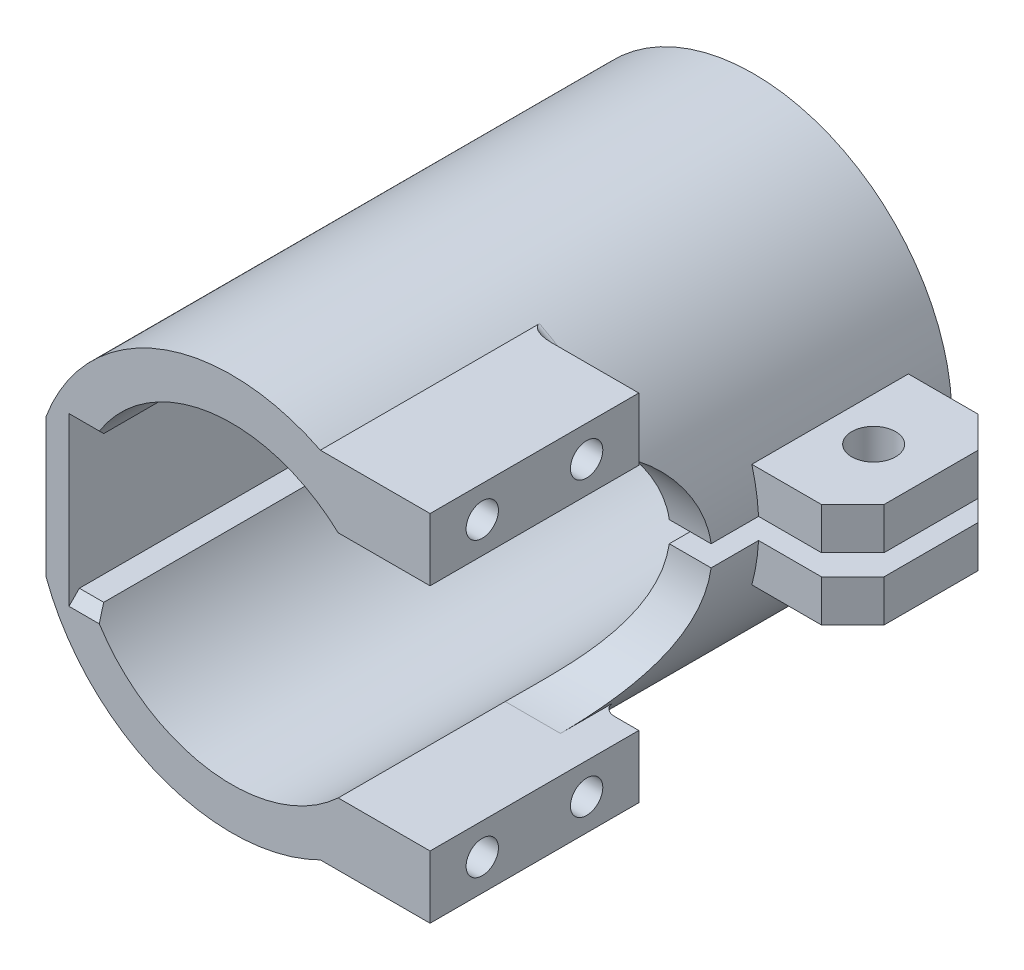
from build123d import *

# Parameters (mm, degrees)
SKETCH_1_R                = 19
EXTRUDE_2_DEPTH           = 55
SKETCH_11_W               = 5
SKETCH_11_H               = 14
CUT_EXTRUDE_10_DEPTH      = 40
EXTRUDE_4_DEPTH           = 9
EXTRUDE_4_DEPTH_BACK      = 2
SKETCH_12_W               = 15
SKETCH_12_H               = 10
SKETCH_13_R               = 2.1
CUT_EXTRUDE_11_DEPTH      = 67.219332525
SKETCH_19_R               = 19
CUT_EXTRUDE_17_DEPTH      = 5
CUT_EXTRUDE_19_DEPTH      = 61.373835392
CUT_EXTRUDE_20_DEPTH      = 47.230401253
CUT_EXTRUDE_20_DEPTH_BACK = 47.230401253
SKETCH_14_W               = 20
SKETCH_14_H               = 2
CUT_EXTRUDE_21_DEPTH      = 10
SKETCH_24_W               = 20
SKETCH_24_H               = 6
EXTRUDE_5_DEPTH           = 20
SKETCH_3_R                = 15
CUT_EXTRUDE_1_DEPTH       = 61.373835507
CHAMFER_2_SIZE            = 3
CHAMFER_3_SIZE            = 1
FILLET_2_R                = 1
SKETCH_25_R               = 1.55
CUT_EXTRUDE_22_DEPTH      = 8
PATTERN_LINEAR_1_COUNT    = 2
PATTERN_LINEAR_1_PITCH    = 10
MIRROR_2_COPY_1_SKETCH_R  = 1.55
MIRROR_2_COPY_1_DEPTH     = 8
MIRROR_2_COPY_2_SKETCH_R  = 1.55
MIRROR_2_COPY_2_DEPTH     = 8
FILLET_2_OF_MIRROR_2_R    = 1


with BuildPart() as part:
    # 草圖1 → 填料-伸長2 (new body)
    with BuildSketch(Plane.XY):
        Circle(SKETCH_1_R)
    extrude(amount=EXTRUDE_2_DEPTH)

    # 草圖11 → 除料-伸長10 (cut)
    with BuildSketch(Plane.XY.offset(55)):
        with Locations((-13.1, 0)):
            Rectangle(SKETCH_11_W, SKETCH_11_H)
    extrude(amount=-CUT_EXTRUDE_10_DEPTH, mode=Mode.SUBTRACT)

    # 草圖12 → 填料-伸長4 (add, two sides: drawn at the far end of the back side and taken through both)
    with BuildSketch(Plane(origin=(19, 0, 0), x_dir=(0, 0, -1), z_dir=(1, 0, 0)).offset(-EXTRUDE_4_DEPTH_BACK)):
        with Locations((-16, 0)):
            Rectangle(SKETCH_12_W, SKETCH_12_H)
    extrude(amount=EXTRUDE_4_DEPTH + EXTRUDE_4_DEPTH_BACK)

    # 草圖13 → 除料-伸長11 (cut, through all)
    with BuildSketch(Plane.XZ.offset(5)):
        with Locations(Location((22.5, 16, 0), (0, 0, 270))):
            Circle(SKETCH_13_R)
    extrude(amount=-CUT_EXTRUDE_11_DEPTH, mode=Mode.SUBTRACT)

    # 草圖19 → 除料-伸長17 (cut)
    with BuildSketch(Plane(origin=(0, 0, 0), x_dir=(-1, 0, 0), z_dir=(0, 0, -1))):
        Circle(SKETCH_19_R)
    extrude(amount=-CUT_EXTRUDE_17_DEPTH, mode=Mode.SUBTRACT)

    # 草圖22 → 除料-伸長19 (cut, through all)
    with BuildSketch(Plane(origin=(0, 0, 5), x_dir=(-1, 0, 0), z_dir=(0, 0, -1))):
        with BuildLine():
            Line((17.8, 6.64529909), (17.8, -6.64529909))
            ThreePointArc((17.8, -6.64529909), (19, 0), (17.8, 6.64529909))
        make_face()
    extrude(amount=-CUT_EXTRUDE_19_DEPTH, mode=Mode.SUBTRACT)

    # 草圖14 → 除料-伸長20 (cut, two sides: drawn at the far end of the back side and taken through both)
    with BuildSketch(Plane.XY.offset(23.5).offset(-CUT_EXTRUDE_20_DEPTH_BACK)):
        with Locations((23.16515139, 0)):
            Rectangle(SKETCH_14_W, SKETCH_14_H)
    extrude(amount=CUT_EXTRUDE_20_DEPTH + CUT_EXTRUDE_20_DEPTH_BACK, mode=Mode.SUBTRACT)

    # 草圖23 → 除料-伸長21 (cut)
    with BuildSketch(Plane(origin=(19, 0, 0), x_dir=(0, 0, -1), z_dir=(1, 0, 0))):
        with BuildLine():
            Line((-39, 11), (-55, 11))
            Line((-55, 11), (-55, -11))
            Line((-55, -11), (-39, -11))
            ThreePointArc((-39, -11), (-28, 0), (-39, 11))
        make_face()
    extrude(amount=-CUT_EXTRUDE_21_DEPTH, mode=Mode.SUBTRACT)

    # 草圖24 → 填料-伸長5 (add)
    with BuildSketch(Plane(origin=(19, 0, 0), x_dir=(0, 0, -1), z_dir=(1, 0, 0))):
        with Locations((-45, 14)):
            Rectangle(SKETCH_24_W, SKETCH_24_H)
    extrude_5 = extrude(amount=-EXTRUDE_5_DEPTH)

    # 草圖3 → 除料-伸長1 (cut, through all)
    with BuildSketch(Plane.XY.offset(55)):
        Circle(SKETCH_3_R)
    cut_extrude_1 = extrude(amount=-CUT_EXTRUDE_1_DEPTH, mode=Mode.SUBTRACT)

    # 導角2
    chamfer_2_edges = [part.edges().sort_by_distance(p)[0] for p in [
        (28, 3, 23.5),
        (28, -3, 8.5),
        (28, -3, 23.5),
        (28, 3, 8.5),
    ]]
    chamfer(chamfer_2_edges, length=CHAMFER_2_SIZE)

    # 導角3
    chamfer_3_edges = [part.edges().sort_by_distance(p)[0] for p in [
        (-14.433249581, 7, 55),
        (-14.433249581, -7, 55),
    ]]
    chamfer(chamfer_3_edges, length=CHAMFER_3_SIZE)

    # 圓角2
    fillet_2_edges = [part.edges().sort_by_distance(p)[0] for p in [
        (12.35826472, 14.431676725, 35),
    ]]
    fillet(fillet_2_edges, radius=FILLET_2_R)

    # 草圖25 → 除料-伸長22 (cut)
    with BuildSketch(Plane(origin=(19, 0, 0), x_dir=(0, 0, -1), z_dir=(1, 0, 0))):
        with Locations((-50, 14)):
            Circle(SKETCH_25_R)
    cut_extrude_22 = extrude(amount=-CUT_EXTRUDE_22_DEPTH, mode=Mode.SUBTRACT)

    # 直線複製排列1: 除料-伸長22 ×2
    with Locations(*[(0, 0, -i * PATTERN_LINEAR_1_PITCH) for i in range(1, PATTERN_LINEAR_1_COUNT)]):
        add(cut_extrude_22, mode=Mode.SUBTRACT)

    # 鏡射2: 填料-伸長5, 除料-伸長1 across plane
    add(extrude_5.mirror(Plane.ZX))
    add(cut_extrude_1.mirror(Plane.ZX), mode=Mode.SUBTRACT)

    # 鏡射2 copy 1 sketch → 鏡射2 copy 1 (cut)
    with BuildSketch(Plane(origin=(19, 0, -10), x_dir=(0, 0, -1), z_dir=(1, 0, 0))):
        with Locations((-50, -14)):
            Circle(MIRROR_2_COPY_1_SKETCH_R)
    extrude(amount=-MIRROR_2_COPY_1_DEPTH, mode=Mode.SUBTRACT)

    # 鏡射2 copy 2 sketch → 鏡射2 copy 2 (cut)
    with BuildSketch(Plane(origin=(19, 0, 0), x_dir=(0, 0, -1), z_dir=(1, 0, 0))):
        with Locations((-50, -14)):
            Circle(MIRROR_2_COPY_2_SKETCH_R)
    extrude(amount=-MIRROR_2_COPY_2_DEPTH, mode=Mode.SUBTRACT)

    # 圓角2 of 鏡射2
    fillet_2_of_mirror_2_edges = [part.edges().sort_by_distance(p)[0] for p in [
        (12.35826472, -14.431676725, 35),
    ]]
    fillet(fillet_2_of_mirror_2_edges, radius=FILLET_2_OF_MIRROR_2_R)


solid = part.part
